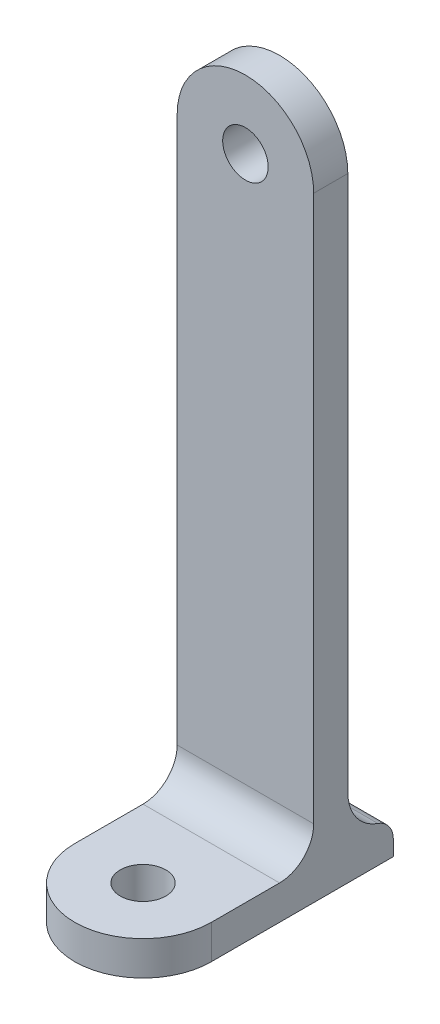
from build123d import *

# Parameters (mm, degrees)
SKETCH1_R           = 6
SKETCH1_R_2         = 2
BOSS_EXTRUDE1_DEPTH = 3
SKETCH2_W           = 3
SKETCH2_H           = 57
BOSS_EXTRUDE2_DEPTH = 12
CUT_EXTRUDE1_REACH  = 64.137
SKETCH3_R           = 2
FILLET1_R           = 3
FILLET2_R           = 3.9
FILLET3_R           = 2


with BuildPart() as part:
    # Sketch1 → Boss-Extrude1 (new body)
    # profile 1 of 2: a face of its own
    with BuildSketch(Plane(origin=(0, 0, 0), x_dir=(1, 0, 0), z_dir=(0, 1, 0))):
        with BuildLine():
            Line((-6, 16), (-6, 0))
            ThreePointArc((-6, 0), (0, 6), (6, 0))
            Line((6, 0), (6, 16))
            Line((6, 16), (-6, 16))
        make_face()
    # profile 2 of 2: a face of its own
    with BuildSketch(Plane(origin=(0, 0, 0), x_dir=(1, 0, 0), z_dir=(0, 1, 0))):
        Circle(SKETCH1_R)
        with Locations(Location((0, 0, 0), (0, 0, 270))):
            Circle(SKETCH1_R_2, mode=Mode.SUBTRACT)
    extrude(amount=BOSS_EXTRUDE1_DEPTH)

    # Sketch2 → Boss-Extrude2 (add)
    with BuildSketch(Plane(origin=(6, 0, 0), x_dir=(0, 0, -1), z_dir=(1, 0, 0))):
        with Locations((10.5, 31.5)):
            Rectangle(SKETCH2_W, SKETCH2_H)
    extrude(amount=-BOSS_EXTRUDE2_DEPTH)

    # Sketch3 → Cut-Extrude1 (cut, up to next)
    with BuildSketch(Plane.XY.offset(-9), mode=Mode.PRIVATE) as cut_extrude1_sk1:
        with BuildLine():
            Line((-6, 60), (-6, 54))
            ThreePointArc((-6, 54), (-4.242640687, 58.242640687), (0, 60))
            Line((0, 60), (-6, 60))
        make_face()
    cut_extrude1_tool1 = extrude(cut_extrude1_sk1.sketch, amount=-CUT_EXTRUDE1_REACH, mode=Mode.PRIVATE) & part.part
    # Sketch3 → Cut-Extrude1 (cut, up to next)
    with BuildSketch(Plane.XY.offset(-9), mode=Mode.PRIVATE) as cut_extrude1_sk2:
        with BuildLine():
            ThreePointArc((0, 60), (4.242640687, 58.242640687), (6, 54))
            Line((6, 54), (6, 60))
            Line((6, 60), (0, 60))
        make_face()
    cut_extrude1_tool2 = extrude(cut_extrude1_sk2.sketch, amount=-CUT_EXTRUDE1_REACH, mode=Mode.PRIVATE) & part.part
    # Sketch3 → Cut-Extrude1 (cut, up to next)
    with BuildSketch(Plane.XY.offset(-9), mode=Mode.PRIVATE) as cut_extrude1_sk3:
        with Locations((0, 54)):
            Circle(SKETCH3_R)
    cut_extrude1_tool3 = extrude(cut_extrude1_sk3.sketch, amount=-CUT_EXTRUDE1_REACH, mode=Mode.PRIVATE) & part.part
    add(cut_extrude1_tool1.solids().sort_by_distance((-4.659792, 58.659792, -9))[0], mode=Mode.SUBTRACT)
    add(cut_extrude1_tool2.solids().sort_by_distance((4.659792, 58.659792, -9))[0], mode=Mode.SUBTRACT)
    add(cut_extrude1_tool3.solids().sort_by_distance((0, 54, -9))[0], mode=Mode.SUBTRACT)

    # Fillet1
    fillet1_edges = [part.edges().sort_by_distance(p)[0] for p in [
        (0, 3, -9),
    ]]
    fillet(fillet1_edges, radius=FILLET1_R)

    # Fillet2
    fillet2_edges = [part.edges().sort_by_distance(p)[0] for p in [
        (0, 3, -12),
    ]]
    fillet(fillet2_edges, radius=FILLET2_R)

    # Fillet3
    fillet3_edges = [part.edges().sort_by_distance(p)[0] for p in [
        (0, 3, -16),
    ]]
    fillet(fillet3_edges, radius=FILLET3_R)


solid = part.part
